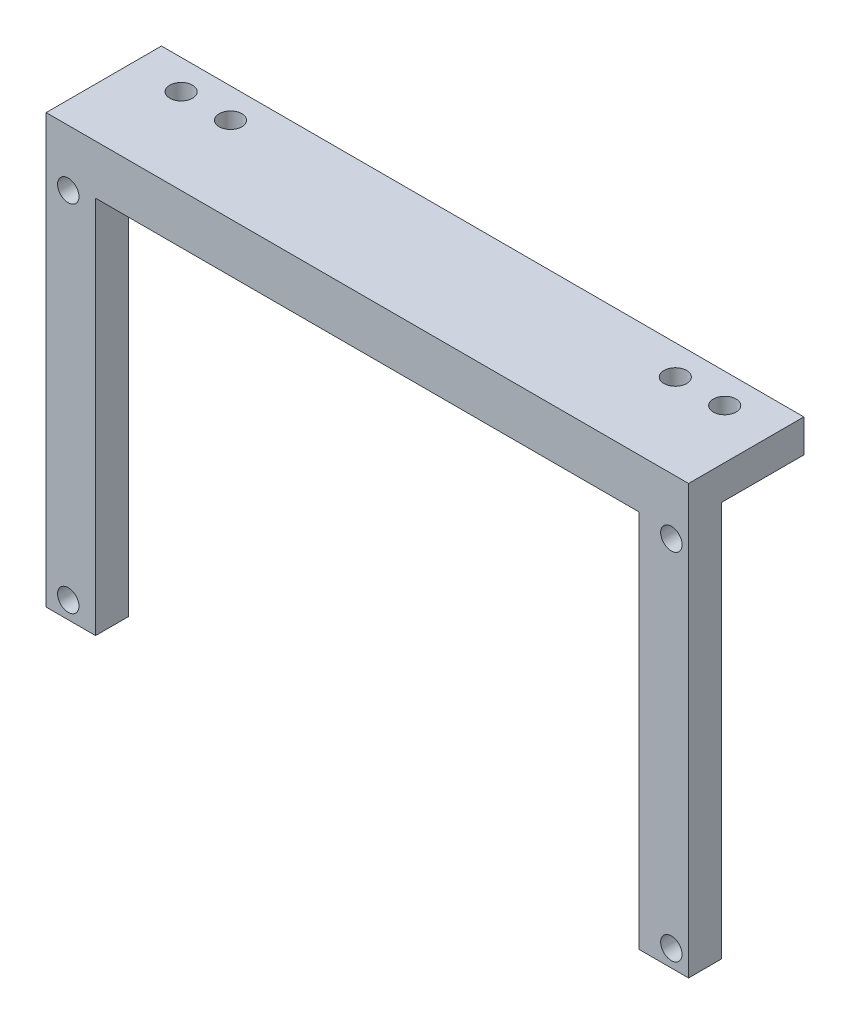
from build123d import *

# Parameters (mm, degrees)
BOSS_EXTRUDE1_DEPTH = 99.06
SKETCH2_W           = 83.82
SKETCH2_H           = 60.96
CUT_EXTRUDE1_DEPTH  = 86.106
SKETCH3_R           = 1.65
CUT_EXTRUDE2_DEPTH  = 228.6
SKETCH4_R           = 1.7526
CUT_EXTRUDE3_DEPTH  = 228.6


with BuildPart() as part:
    # Sketch1 → Boss-Extrude1 (new body)
    with BuildSketch(Plane(origin=(0, 0, 0), x_dir=(0, 0, -1), z_dir=(1, 0, 0))):
        Polygon((-29.897403577, 26.181538462), (-12.117403577, 26.181538462), (-12.117403577, 21.101538462), (-24.817403577, 21.101538462), (-24.817403577, -39.858461538), (-29.897403577, -39.858461538), align=None)
    extrude(amount=BOSS_EXTRUDE1_DEPTH)

    # Sketch2 → Cut-Extrude1 (cut)
    with BuildSketch(Plane.XY):
        with Locations((49.53, -11.918461538)):
            Rectangle(SKETCH2_W, SKETCH2_H)
    extrude(amount=CUT_EXTRUDE1_DEPTH, mode=Mode.SUBTRACT)

    # Sketch3 → Cut-Extrude2 (cut)
    with BuildSketch(Plane.XY):
        with Locations(Location((96.41, -37.208461538, 0), (0, 0, 180))):
            Circle(SKETCH3_R)
        with Locations(Location((96.41, 17.491538462, 0), (0, 0, 180))):
            Circle(SKETCH3_R)
        with Locations(Location((3.41, 17.491538462, 0), (0, 0, 180))):
            Circle(SKETCH3_R)
        with Locations(Location((3.41, -37.208461538, 0), (0, 0, 180))):
            Circle(SKETCH3_R)
    extrude(amount=CUT_EXTRUDE2_DEPTH, mode=Mode.SUBTRACT)

    # Sketch4 → Cut-Extrude3 (cut)
    with BuildSketch(Plane(origin=(0, 0, 0), x_dir=(1, 0, 0), z_dir=(0, 1, 0))):
        with Locations(Location((7.62, -16.70215043, 0), (0, 0, 90))):
            Circle(SKETCH4_R)
        with Locations(Location((15.24, -16.70215043, 0), (0, 0, 90))):
            Circle(SKETCH4_R)
        with Locations(Location((83.82, -16.70215043, 0), (0, 0, 90))):
            Circle(SKETCH4_R)
        with Locations(Location((91.44, -16.70215043, 0), (0, 0, 90))):
            Circle(SKETCH4_R)
    extrude(amount=CUT_EXTRUDE3_DEPTH, mode=Mode.SUBTRACT)


solid = part.part
